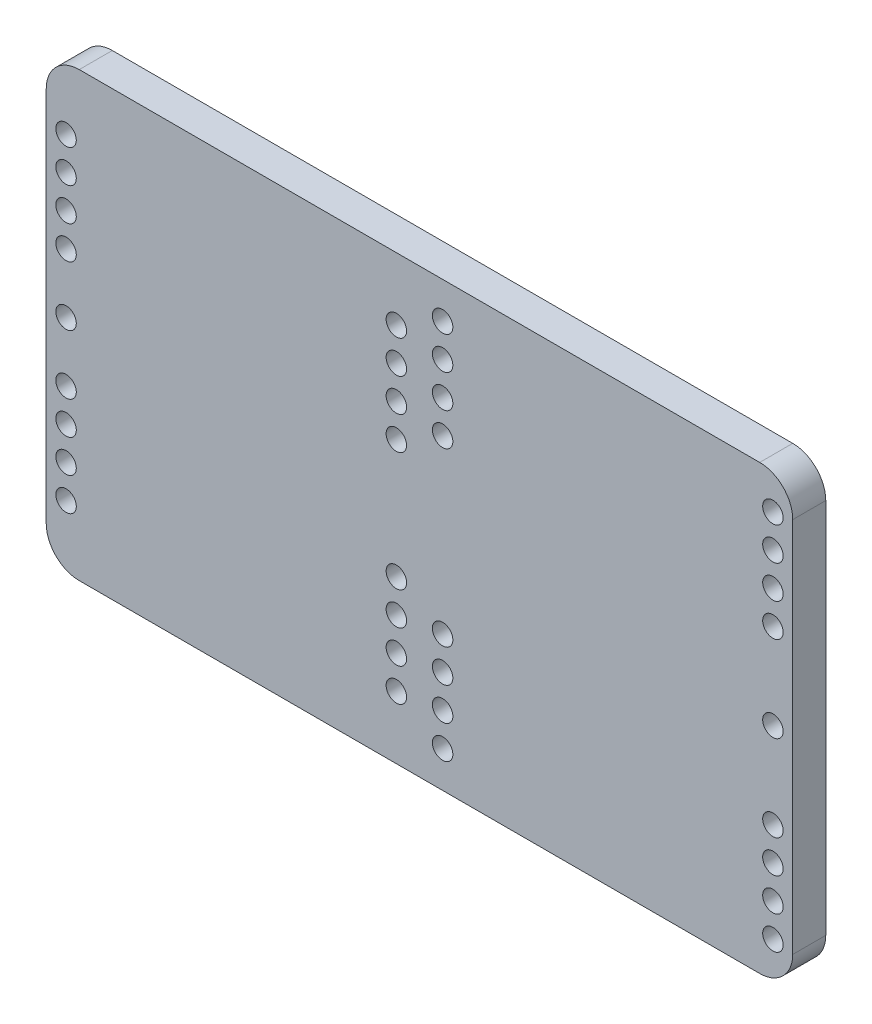
from build123d import *

# Parameters (mm, degrees)
SKETCH_1_R      = 1.55
EXTRUDE_2_DEPTH = 5


with BuildPart() as part:
    # 草图1 → 凸台-拉伸2 (new body)
    with BuildSketch(Plane.XY):
        with BuildLine():
            Line((5, 0), (108, 0))
            ThreePointArc((108, 0), (111.535533906, 1.464466094), (113, 5))
            Line((113, 5), (113, 62))
            ThreePointArc((113, 62), (111.535533906, 65.535533906), (108, 67))
            Line((108, 67), (5, 67))
            ThreePointArc((5, 67), (1.464466094, 65.535533906), (0, 62))
            Line((0, 62), (0, 5))
            ThreePointArc((0, 5), (1.464466094, 1.464466094), (5, 0))
        make_face()
        with Locations((3, 33.5)):
            Circle(SKETCH_1_R, mode=Mode.SUBTRACT)
        with Locations(Location((110, 33.5, 0), (0, 0, 180))):
            Circle(SKETCH_1_R, mode=Mode.SUBTRACT)
        with Locations((3, 42.5)):
            Circle(SKETCH_1_R, mode=Mode.SUBTRACT)
        with Locations((3, 47.5)):
            Circle(SKETCH_1_R, mode=Mode.SUBTRACT)
        with Locations((3, 52.5)):
            Circle(SKETCH_1_R, mode=Mode.SUBTRACT)
        with Locations((3, 57.5)):
            Circle(SKETCH_1_R, mode=Mode.SUBTRACT)
        with Locations(Location((3, 24.5, 0), (0, 0, 180))):
            Circle(SKETCH_1_R, mode=Mode.SUBTRACT)
        with Locations(Location((3, 19.5, 0), (0, 0, 180))):
            Circle(SKETCH_1_R, mode=Mode.SUBTRACT)
        with Locations(Location((3, 14.5, 0), (0, 0, 180))):
            Circle(SKETCH_1_R, mode=Mode.SUBTRACT)
        with Locations(Location((3, 9.5, 0), (0, 0, 180))):
            Circle(SKETCH_1_R, mode=Mode.SUBTRACT)
        with Locations((53, 9.5)):
            Circle(SKETCH_1_R, mode=Mode.SUBTRACT)
        with Locations((53, 14.5)):
            Circle(SKETCH_1_R, mode=Mode.SUBTRACT)
        with Locations((53, 19.5)):
            Circle(SKETCH_1_R, mode=Mode.SUBTRACT)
        with Locations((53, 24.5)):
            Circle(SKETCH_1_R, mode=Mode.SUBTRACT)
        with Locations(Location((53, 42.5, 0), (0, 0, 180))):
            Circle(SKETCH_1_R, mode=Mode.SUBTRACT)
        with Locations(Location((53, 47.5, 0), (0, 0, 180))):
            Circle(SKETCH_1_R, mode=Mode.SUBTRACT)
        with Locations(Location((53, 52.5, 0), (0, 0, 180))):
            Circle(SKETCH_1_R, mode=Mode.SUBTRACT)
        with Locations(Location((53, 57.5, 0), (0, 0, 180))):
            Circle(SKETCH_1_R, mode=Mode.SUBTRACT)
        with Locations((110, 46.5)):
            Circle(SKETCH_1_R, mode=Mode.SUBTRACT)
        with Locations((110, 51.5)):
            Circle(SKETCH_1_R, mode=Mode.SUBTRACT)
        with Locations((110, 56.5)):
            Circle(SKETCH_1_R, mode=Mode.SUBTRACT)
        with Locations((110, 61.5)):
            Circle(SKETCH_1_R, mode=Mode.SUBTRACT)
        with Locations(Location((110, 20.5, 0), (0, 0, 180))):
            Circle(SKETCH_1_R, mode=Mode.SUBTRACT)
        with Locations(Location((110, 15.5, 0), (0, 0, 180))):
            Circle(SKETCH_1_R, mode=Mode.SUBTRACT)
        with Locations(Location((110, 10.5, 0), (0, 0, 180))):
            Circle(SKETCH_1_R, mode=Mode.SUBTRACT)
        with Locations(Location((110, 5.5, 0), (0, 0, 180))):
            Circle(SKETCH_1_R, mode=Mode.SUBTRACT)
        with Locations(Location((60, 61.5, 0), (0, 0, 180))):
            Circle(SKETCH_1_R, mode=Mode.SUBTRACT)
        with Locations(Location((60, 56.5, 0), (0, 0, 180))):
            Circle(SKETCH_1_R, mode=Mode.SUBTRACT)
        with Locations(Location((60, 46.5, 0), (0, 0, 180))):
            Circle(SKETCH_1_R, mode=Mode.SUBTRACT)
        with Locations(Location((60, 51.5, 0), (0, 0, 180))):
            Circle(SKETCH_1_R, mode=Mode.SUBTRACT)
        with Locations((60, 20.5)):
            Circle(SKETCH_1_R, mode=Mode.SUBTRACT)
        with Locations((60, 15.5)):
            Circle(SKETCH_1_R, mode=Mode.SUBTRACT)
        with Locations((60, 10.5)):
            Circle(SKETCH_1_R, mode=Mode.SUBTRACT)
        with Locations((60, 5.5)):
            Circle(SKETCH_1_R, mode=Mode.SUBTRACT)
    extrude(amount=EXTRUDE_2_DEPTH)


solid = part.part
